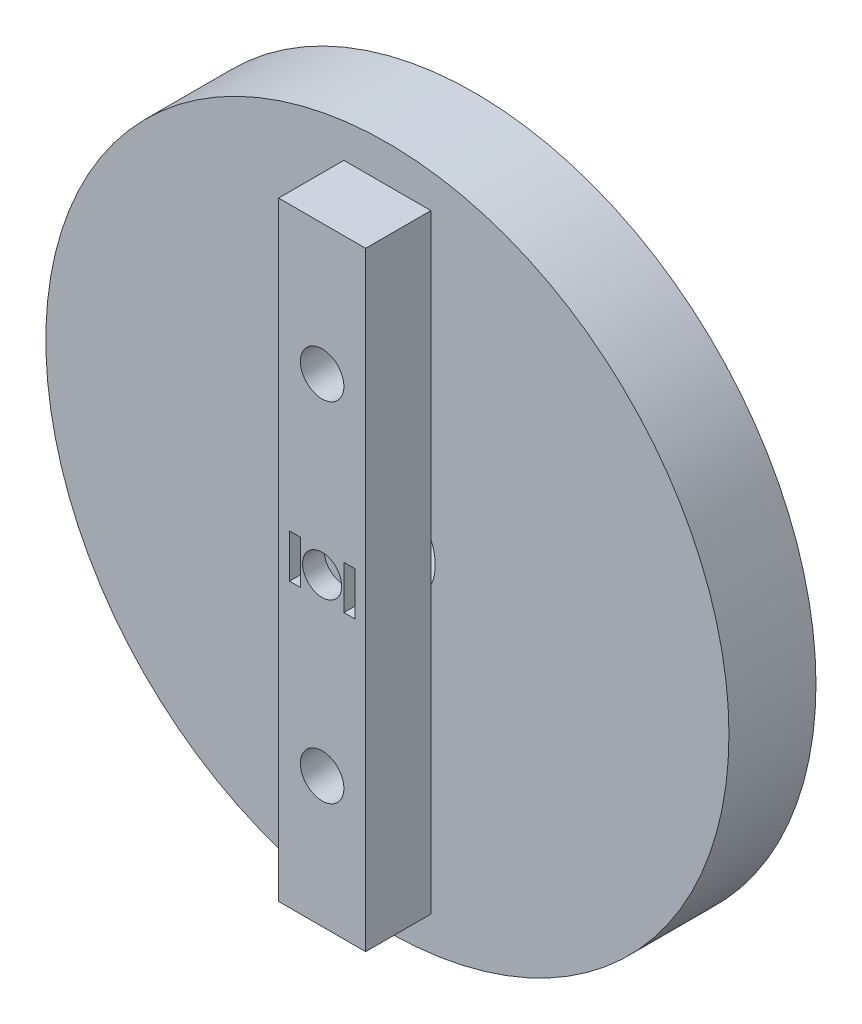
from build123d import *

# Parameters (mm, degrees)
SKETCH_1_R          = 15.7
EXTRUDE_1_DEPTH     = 4
SKETCH_2_R          = 2.2
CUT_EXTRUDE_1_DEPTH = 4
SKETCH_3_W          = 4
SKETCH_3_H          = 28
EXTRUDE_2_DEPTH     = 3
SKETCH_5_R          = 0.9
CUT_EXTRUDE_3_DEPTH = 1
SKETCH_6_R          = 0.4
CUT_EXTRUDE_4_DEPTH = 2
SKETCH_7_W          = 0.5
SKETCH_7_H          = 2
CUT_EXTRUDE_5_DEPTH = 3
SKETCH_8_R          = 1
CUT_EXTRUDE_6_DEPTH = 5


with BuildPart() as part:
    # 草图1 → 凸台-拉伸1 (new body)
    with BuildSketch(Plane.XY):
        Circle(SKETCH_1_R)
    extrude(amount=EXTRUDE_1_DEPTH)

    # 草图2 → 切除-拉伸1 (cut)
    with BuildSketch(Plane(origin=(0, 0, 0), x_dir=(-1, 0, 0), z_dir=(0, 0, -1))):
        Circle(SKETCH_2_R)
    extrude(amount=-CUT_EXTRUDE_1_DEPTH, mode=Mode.SUBTRACT)


with BuildPart() as body_2:
    # 草图3 → 凸台-拉伸2 (new body)
    with BuildSketch(Plane.XY.offset(4)):
        Rectangle(SKETCH_3_W, SKETCH_3_H)
    extrude(amount=EXTRUDE_2_DEPTH)

    # 草图5 → 切除-拉伸3 (cut)
    with BuildSketch(Plane.XY.offset(7)):
        Circle(SKETCH_5_R)
    extrude(amount=-CUT_EXTRUDE_3_DEPTH, mode=Mode.SUBTRACT)

    # 草图6 → 切除-拉伸4 (cut)
    with BuildSketch(Plane.XY.offset(6)):
        Circle(SKETCH_6_R)
    extrude(amount=-CUT_EXTRUDE_4_DEPTH, mode=Mode.SUBTRACT)

    # 草图7 → 切除-拉伸5 (cut)
    with BuildSketch(Plane.XY.offset(7)):
        with Locations((1.25, 0)):
            Rectangle(SKETCH_7_W, SKETCH_7_H)
        with Locations((-1.25, 0)):
            Rectangle(SKETCH_7_W, SKETCH_7_H)
    extrude(amount=-CUT_EXTRUDE_5_DEPTH, mode=Mode.SUBTRACT)


with BuildPart() as cut_extrude_6_tool:
    # 草图8 → 切除-拉伸6 (new body)
    with BuildSketch(Plane.XY.offset(7)):
        with Locations((0, 8)):
            Circle(SKETCH_8_R)
        with Locations((0, -8)):
            Circle(SKETCH_8_R)
    extrude(amount=-CUT_EXTRUDE_6_DEPTH)


with BuildPart() as part_1:
    add(part.part)

    # 切除-拉伸6: cut by cut_extrude_6_tool
    add(cut_extrude_6_tool.part, mode=Mode.SUBTRACT)


with BuildPart() as body_2_1:
    add(body_2.part)

    # 切除-拉伸6: cut by cut_extrude_6_tool
    add(cut_extrude_6_tool.part, mode=Mode.SUBTRACT)


solid = Compound([part_1.part, body_2_1.part])
